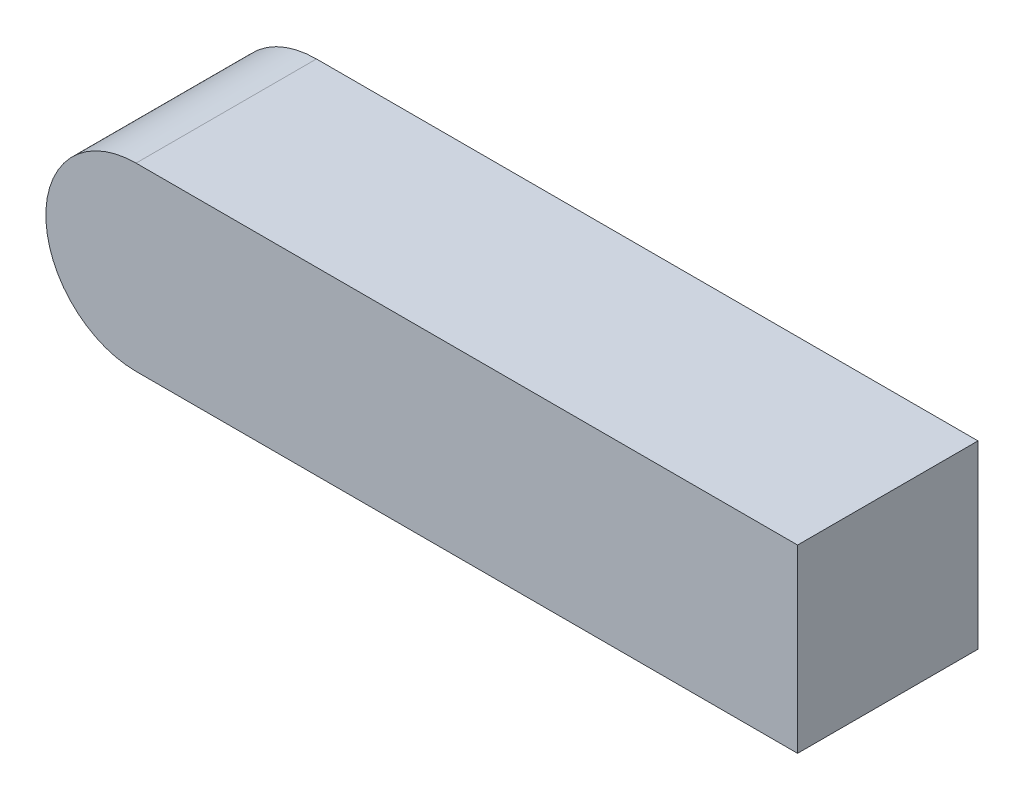
from build123d import *

# Parameters (mm, degrees)
BOSS_EXTRUDE1_DEPTH = 6


with BuildPart() as part:
    # Sketch1 → Boss-Extrude1 (new body)
    with BuildSketch(Plane.XY):
        with BuildLine():
            Line((-22, -3), (0, -3))
            Line((0, -3), (0, 3))
            Line((0, 3), (-22, 3))
            ThreePointArc((-22, 3), (-25, 0), (-22, -3))
        make_face()
    extrude(amount=BOSS_EXTRUDE1_DEPTH)


solid = part.part
